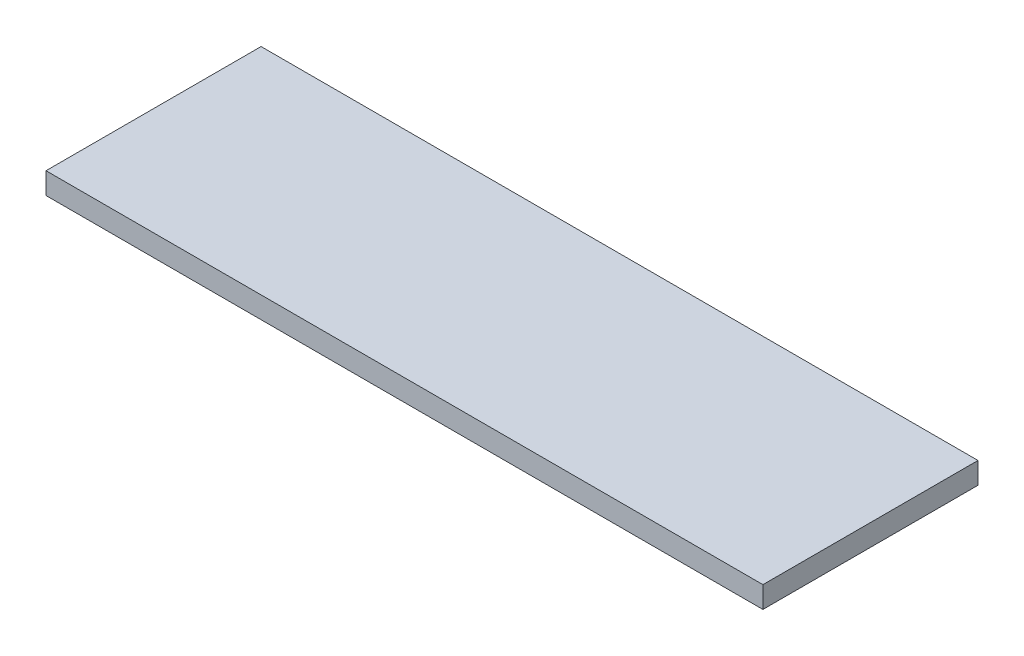
from build123d import *

# Parameters (mm, degrees)
SKETCH1_W           = 500
SKETCH1_H           = 150
BOSS_EXTRUDE1_DEPTH = 15


with BuildPart() as part:
    # Sketch1 → Boss-Extrude1 (new body)
    with BuildSketch(Plane(origin=(0, 0, 0), x_dir=(1, 0, 0), z_dir=(0, 1, 0))):
        with Locations((34, 28.25)):
            Rectangle(SKETCH1_W, SKETCH1_H)
    extrude(amount=BOSS_EXTRUDE1_DEPTH)


solid = part.part
